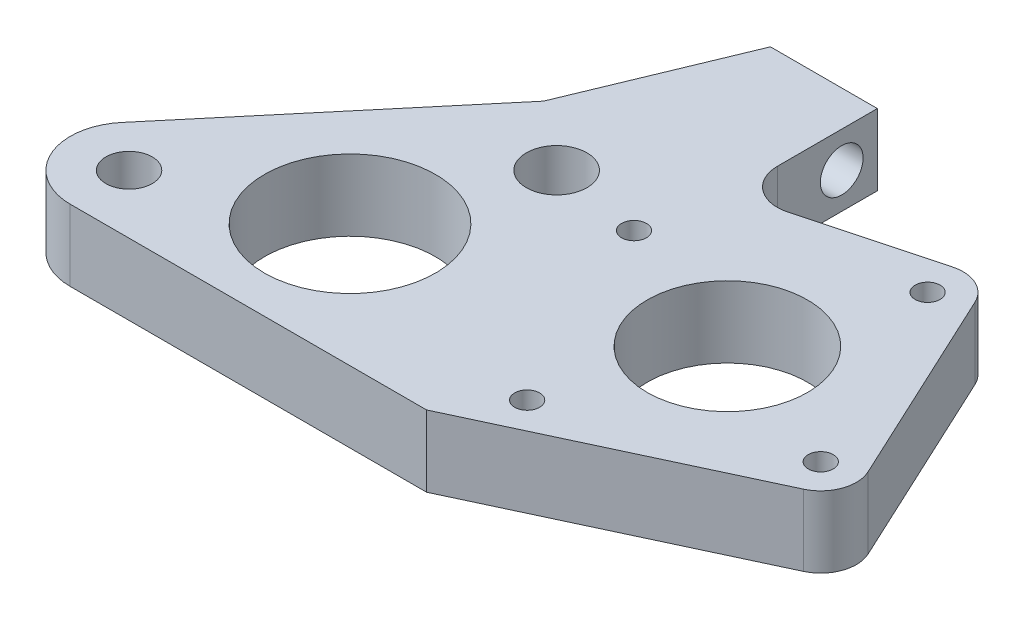
from build123d import *

# Parameters (mm, degrees)
SKETCH1_R           = 3.25
SKETCH1_R_2         = 4.25
SKETCH1_R_3         = 11.25
SKETCH1_R_4         = 1.75
SKETCH1_R_5         = 12
BOSS_EXTRUDE1_DEPTH = 10
FILLET1_R           = 5
SKETCH2_R           = 3
CUT_EXTRUDE1_DEPTH  = 10


with BuildPart() as part:
    # Sketch1 → Boss-Extrude1 (new body)
    with BuildSketch(Plane(origin=(0, 0, 0), x_dir=(1, 0, 0), z_dir=(0, 1, 0))):
        with BuildLine():
            Line((0, -8.25), (50, -8.25))
            Line((50, -8.25), (86.069806885, 8.569627179))
            ThreePointArc((86.069806885, 8.569627179), (88.655178681, 11.391065397), (88.488254512, 15.214257423))
            Line((88.488254512, 15.214257423), (75.387088398, 43.309798821))
            ThreePointArc((75.387088398, 43.309798821), (72.968640771, 45.728246447), (69.561454237, 46.026336644))
            Line((69.561454237, 46.026336644), (45, 39.445114816))
            Line((45, 39.445114816), (45, 60))
            Line((45, 60), (30, 60))
            Line((30, 60), (20.677212951, 37.476864391))
            Line((20.677212951, 37.476864391), (-6.319866656, 5.30299778))
            ThreePointArc((-6.319866656, 5.30299778), (-7.477039243, -3.486600659), (0, -8.25))
        make_face()
        with Locations(Location((0, 0, 0), (0, 0, 270))):
            Circle(SKETCH1_R, mode=Mode.SUBTRACT)
        with Locations(Location((30, 30, 0), (0, 0, 270))):
            Circle(SKETCH1_R_2, mode=Mode.SUBTRACT)
        with Locations(Location((63.358361821, 20.598353756, 0), (0, 0, 270))):
            Circle(SKETCH1_R_3, mode=Mode.SUBTRACT)
        with Locations(Location((42.760008064, 28.095541398, 0), (0, 0, 270))):
            Circle(SKETCH1_R_4, mode=Mode.SUBTRACT)
        with Locations(Location((70.855549463, 41.196707512, 0), (0, 0, 270))):
            Circle(SKETCH1_R_4, mode=Mode.SUBTRACT)
        with Locations(Location((83.956715577, 13.101166114, 0), (0, 0, 270))):
            Circle(SKETCH1_R_4, mode=Mode.SUBTRACT)
        with Locations(Location((55.861174178, 0, 0), (0, 0, 270))):
            Circle(SKETCH1_R_4, mode=Mode.SUBTRACT)
        with Locations(Location((22, 9, 0), (0, 0, 270))):
            Circle(SKETCH1_R_5, mode=Mode.SUBTRACT)
    extrude(amount=BOSS_EXTRUDE1_DEPTH)

    # Fillet1
    fillet1_edges = [part.edges().sort_by_distance(p)[0] for p in [
        (45, 5, -39.445114816),
    ]]
    fillet(fillet1_edges, radius=FILLET1_R)

    # Sketch2 → Cut-Extrude1 (cut)
    with BuildSketch(Plane(origin=(45, 0, 0), x_dir=(0, 0, -1), z_dir=(1, 0, 0))):
        with Locations((55, 5)):
            Circle(SKETCH2_R)
    extrude(amount=-CUT_EXTRUDE1_DEPTH, mode=Mode.SUBTRACT)


solid = part.part
